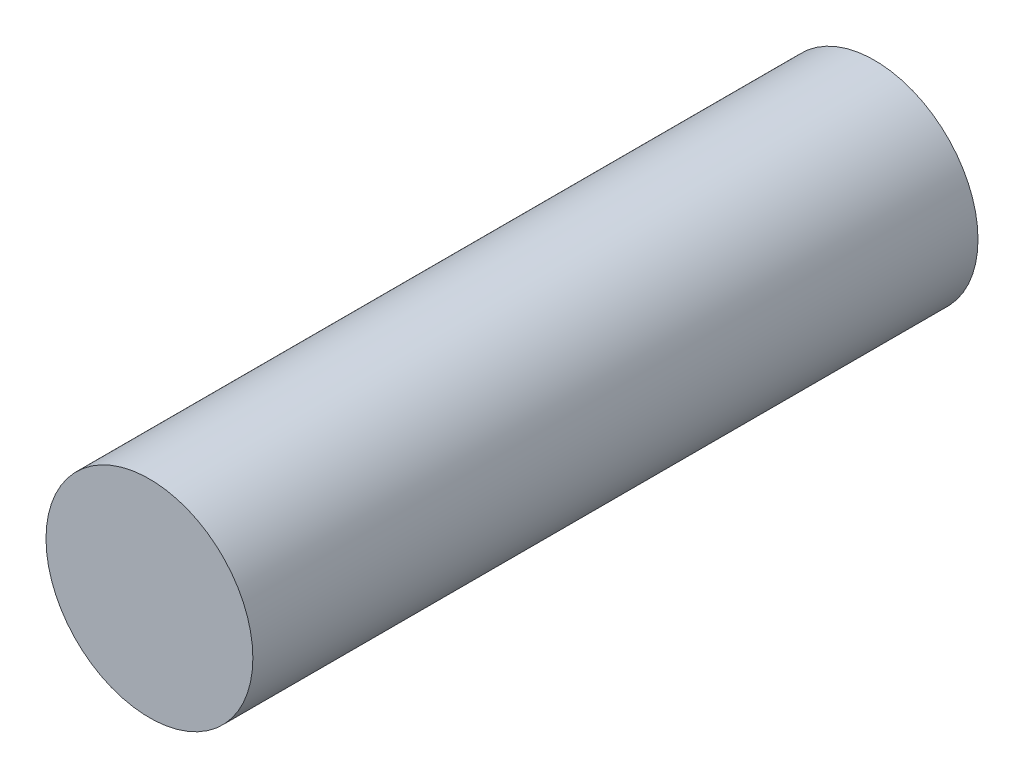
from build123d import *

# Parameters (mm, degrees)
SKETCH_1_R      = 9.3
EXTRUDE_1_DEPTH = 32.6


with BuildPart() as part:
    # Эскиз1 → Бобышка-Вытянуть1 (new, symmetric)
    with BuildSketch(Plane.XY):
        Circle(SKETCH_1_R)
    extrude(amount=EXTRUDE_1_DEPTH, both=True)


solid = part.part
